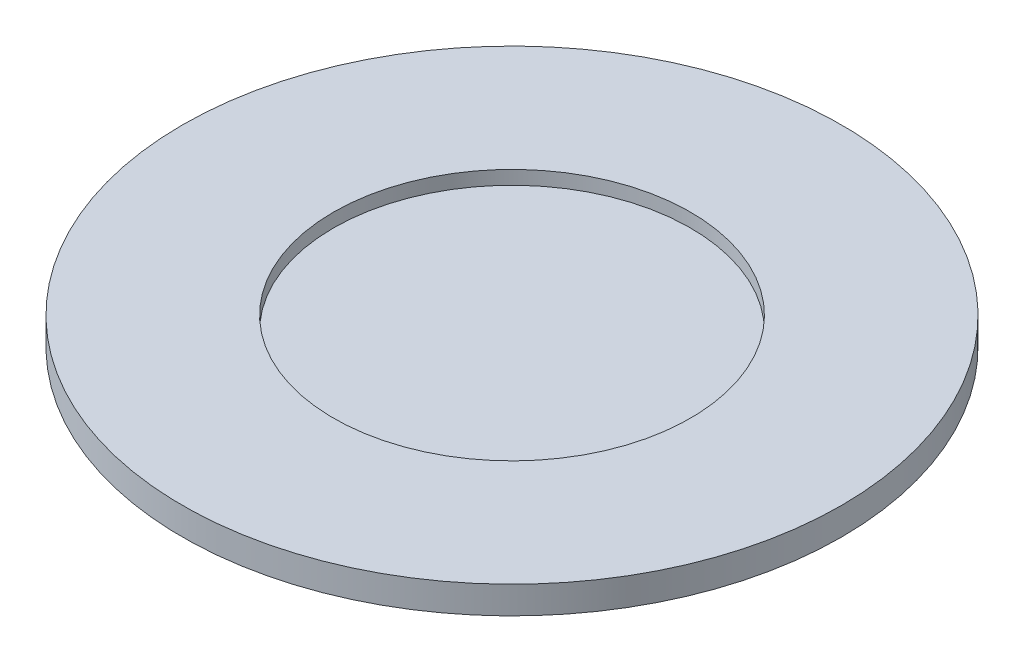
from build123d import *

# Parameters (mm, degrees)
SKETCH1_W = 60
SKETCH1_H = 15


with BuildPart() as part:
    # Эскиз1 → Revolve 449 (revolve)
    with BuildSketch(Plane.XY, mode=Mode.PRIVATE) as revolve_449_sk:
        with BuildLine():
            Line((5, 76.341055046), (60, 76.341055046))
            Line((60, 76.341055046), (60, 66.341055046))
            Line((60, 66.341055046), (15, 66.341055046))
            ThreePointArc((15, 66.341055046), (11.464466094, 64.876588952), (10, 61.341055046))
            Line((10, 61.341055046), (10, 56.341055046))
            Line((10, 56.341055046), (0, 56.341055046))
            Line((0, 56.341055046), (0, 71.341055046))
            Line((0, 71.341055046), (5, 71.341055046))
            Line((5, 71.341055046), (5, 76.341055046))
        make_face()
    revolve(revolve_449_sk.sketch.rotate(Axis((-60, 97.731625762, 0), (0, -1, 0)), 180), axis=Axis((-60, 97.731625762, 0), (0, -1, 0)))

    # Sketch1 → Revolve1 (revolve)
    with BuildSketch(Plane.XY):
        with Locations((-30, 63.841055046)):
            Rectangle(SKETCH1_W, SKETCH1_H)
    revolve(axis=Axis((-60, 66.341055046, 0), (0, 1, 0)))


solid = part.part
